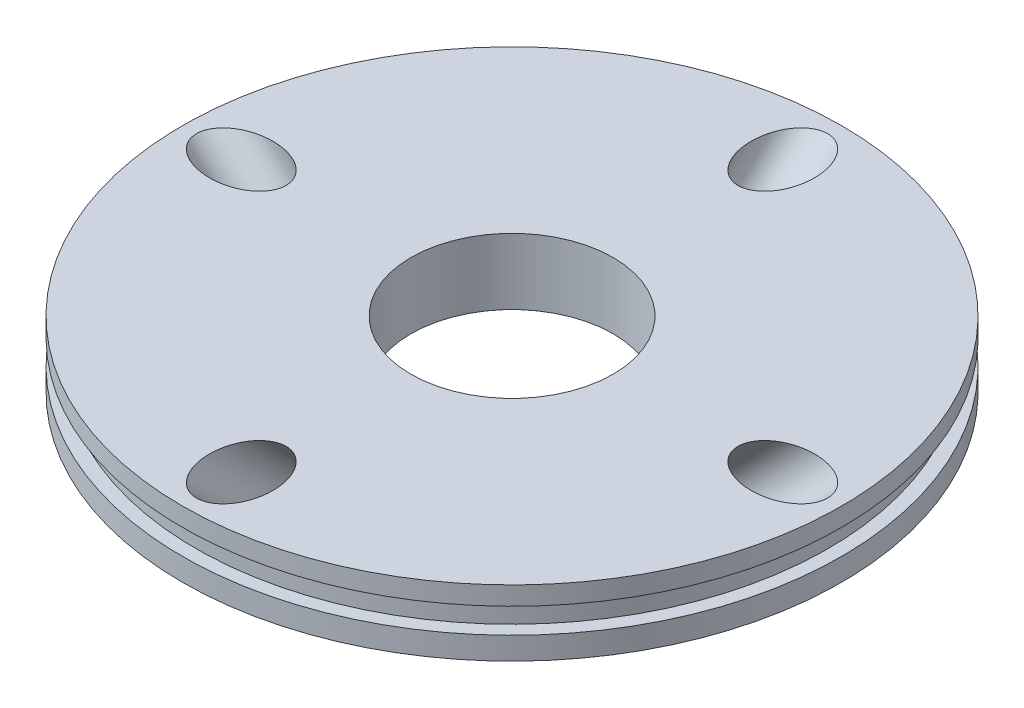
from build123d import *

# Parameters (mm, degrees)
SKETCH1_R                   = 31.6865
BOSS_EXTRUDE1_DEPTH         = 6.35
CIRPATTERN1_COUNT           = 4
SKETCH5_W                   = 1.2954
SKETCH5_H                   = 2.413
F_3_4_CLEARANCE_HOLE1_D     = 19.44624
F_3_4_CLEARANCE_HOLE1_DEPTH = 6.35
F_3_4_CLEARANCE_HOLE1_TIP   = 5.842239902


with BuildPart() as part:
    # Sketch1 → Boss-Extrude1 (new body)
    with BuildSketch(Plane(origin=(0, 0, 0), x_dir=(1, 0, 0), z_dir=(0, 1, 0))):
        with Locations(Location((0, 0, 0), (0, 0, 270))):
            Circle(SKETCH1_R)
    extrude(amount=BOSS_EXTRUDE1_DEPTH)

    # Sketch4 → Cut-Revolve1 (revolve, cut)
    with BuildSketch(Plane.XY, mode=Mode.PRIVATE) as cut_revolve1_sk:
        Polygon((-28.472660076, 8.787660076), (-22.86, 3.175), (-17.247339924, -2.437660076), (-15.092078455, -0.282398607), (-26.317398607, 10.942921545), align=None)
    cut_revolve1 = revolve(cut_revolve1_sk.sketch.rotate(Axis((-28.472660076, 8.787660076, 0), (0.7071067811865512, -0.7071067811865439, 0)), 180), axis=Axis((-28.472660076, 8.787660076, 0), (0.7071067811865512, -0.7071067811865439, 0)), mode=Mode.SUBTRACT)

    # CirPattern1: Cut-Revolve1 ×4 about axis
    cirpattern1_axis = Axis((0, -0.3175, 0), (0, 1, 0))
    for i in range(1, CIRPATTERN1_COUNT):
        add(cut_revolve1.rotate(cirpattern1_axis, i * 360 / CIRPATTERN1_COUNT), mode=Mode.SUBTRACT)

    # Sketch5 → Cut-Revolve2 (revolve, cut)
    with BuildSketch(Plane.XY, mode=Mode.PRIVATE) as cut_revolve2_sk:
        with Locations((31.0388, 3.3655)):
            Rectangle(SKETCH5_W, SKETCH5_H)
    revolve(cut_revolve2_sk.sketch.rotate(Axis((0, -0.3175, 0), (0, 1, 0)), 90), axis=Axis((0, -0.3175, 0), (0, 1, 0)), mode=Mode.SUBTRACT)

    # 3/4 Clearance Hole1
    with Locations(Plane(origin=(0, 6.35, 0), x_dir=(1, 0, 0), z_dir=(0, 1, 0))):
        with Locations((0, 0)):
            Hole(F_3_4_CLEARANCE_HOLE1_D / 2, depth=F_3_4_CLEARANCE_HOLE1_DEPTH)
            with Locations((0, 0, -(F_3_4_CLEARANCE_HOLE1_DEPTH + F_3_4_CLEARANCE_HOLE1_TIP / 2))):  # 118° drill point
                Cone(0, F_3_4_CLEARANCE_HOLE1_D / 2, F_3_4_CLEARANCE_HOLE1_TIP, mode=Mode.SUBTRACT)


solid = part.part
